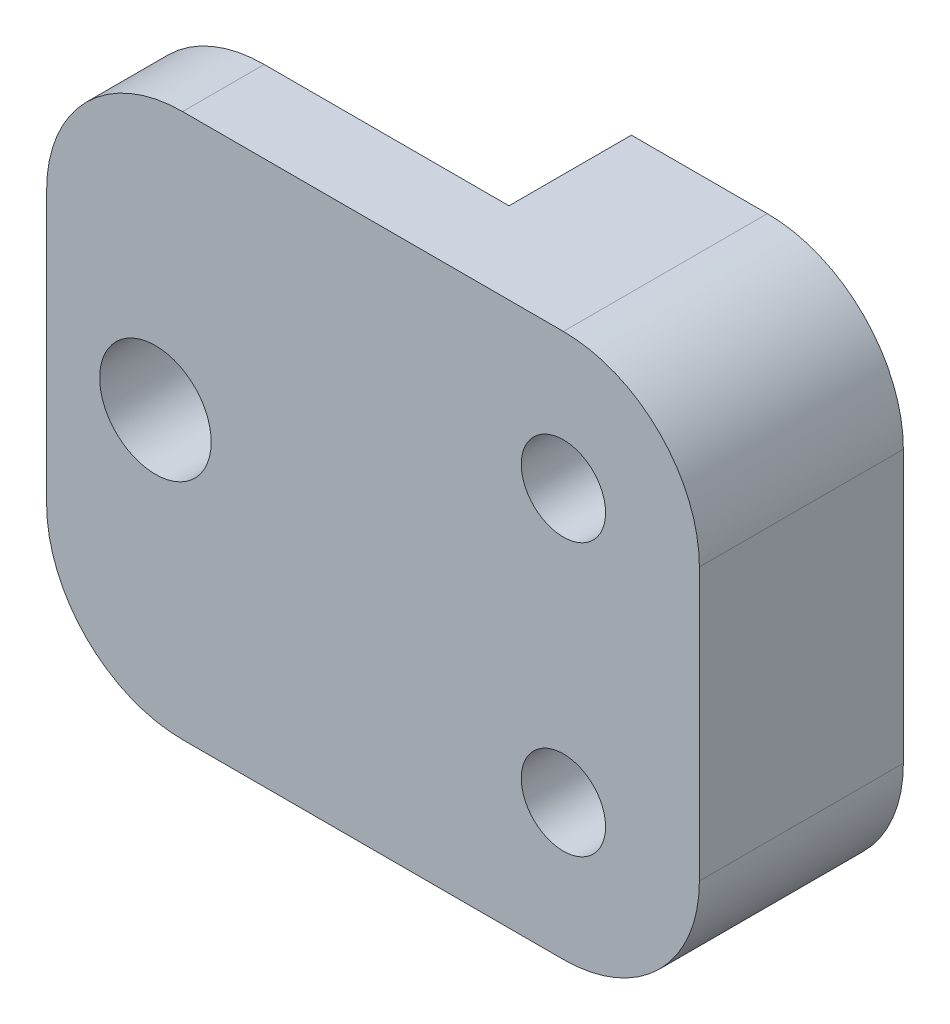
from build123d import *

# Parameters (mm, degrees)
AUFSATZ_LINEAR_AUSTRAGEN1_DEPTH = 20
SKIZZE2_R                       = 2.05
SKIZZE2_R_2                     = 1.55
SCHNITT_LINEAR_AUSTRAGEN1_DEPTH = 25.5
VERRUNDUNG1_R                   = 5


with BuildPart() as part:
    # Skizze1 → Aufsatz-Linear austragen1 (new body)
    with BuildSketch(Plane(origin=(0, 0, 0), x_dir=(1, 0, 0), z_dir=(0, 1, 0))):
        Polygon((2, -4.5), (-12, -4.5), (-12, -7.5), (12, -7.5), (12, 0), (2, 0), align=None)
    extrude(amount=AUFSATZ_LINEAR_AUSTRAGEN1_DEPTH)

    # Skizze2 → Schnitt-Linear austragen1 (cut, through all)
    with BuildSketch(Plane.XY.offset(7.5)):
        with Locations((-8, 10)):
            Circle(SKIZZE2_R)
        with Locations((7, 15)):
            Circle(SKIZZE2_R_2)
        with Locations((7, 5)):
            Circle(SKIZZE2_R_2)
    extrude(amount=-SCHNITT_LINEAR_AUSTRAGEN1_DEPTH, mode=Mode.SUBTRACT)

    # Verrundung1
    verrundung1_edges = [part.edges().sort_by_distance(p)[0] for p in [
        (-12, 20, 6),
        (12, 20, 3.75),
        (12, 0, 3.75),
        (-12, 0, 6),
    ]]
    fillet(verrundung1_edges, radius=VERRUNDUNG1_R)


solid = part.part
